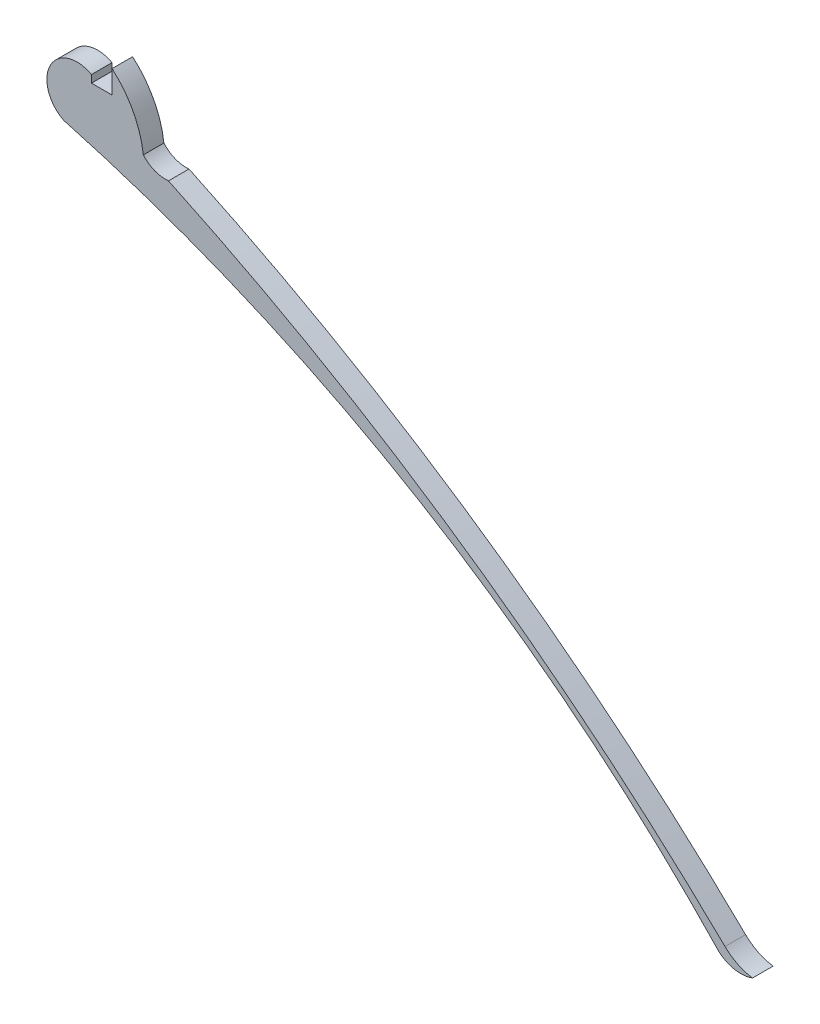
from build123d import *

# Parameters (mm, degrees)
BOSS_EXTRUDE1_DEPTH = 1.524


with BuildPart() as part:
    # Sketch1 → Boss-Extrude1 (new body)
    with BuildSketch(Plane.XY):
        with BuildLine():
            Line((0, 30.238088669), (-1.524, 30.238088669))
            Line((-1.524, 30.238088669), (-1.524, 30.790634065))
            ThreePointArc((-1.524, 30.790634065), (-4.57902006, 29.852179907), (-3.574419861, 26.818267876))
            ThreePointArc((-3.574419861, 26.818267876), (22.721404873, 15.60835362), (45.010506388, -2.289370529))
            ThreePointArc((45.010506388, -2.289370529), (46.184159064, -2.824291441), (47.467988652, -2.700264938))
            ThreePointArc((47.467988652, -2.700264938), (46.368179039, -2.362168668), (45.427846615, -1.69909612))
            ThreePointArc((45.427846615, -1.69909612), (25.999332487, 14.287912382), (4.180950484, 26.818267876))
            ThreePointArc((4.180950484, 26.818267876), (3.159648615, 26.95869619), (2.318491113, 27.55470934))
            ThreePointArc((2.318491113, 27.55470934), (1.568114485, 29.962053436), (0, 31.936740157))
            Line((0, 31.936740157), (0, 30.238088669))
        make_face()
    extrude(amount=BOSS_EXTRUDE1_DEPTH)


solid = part.part
